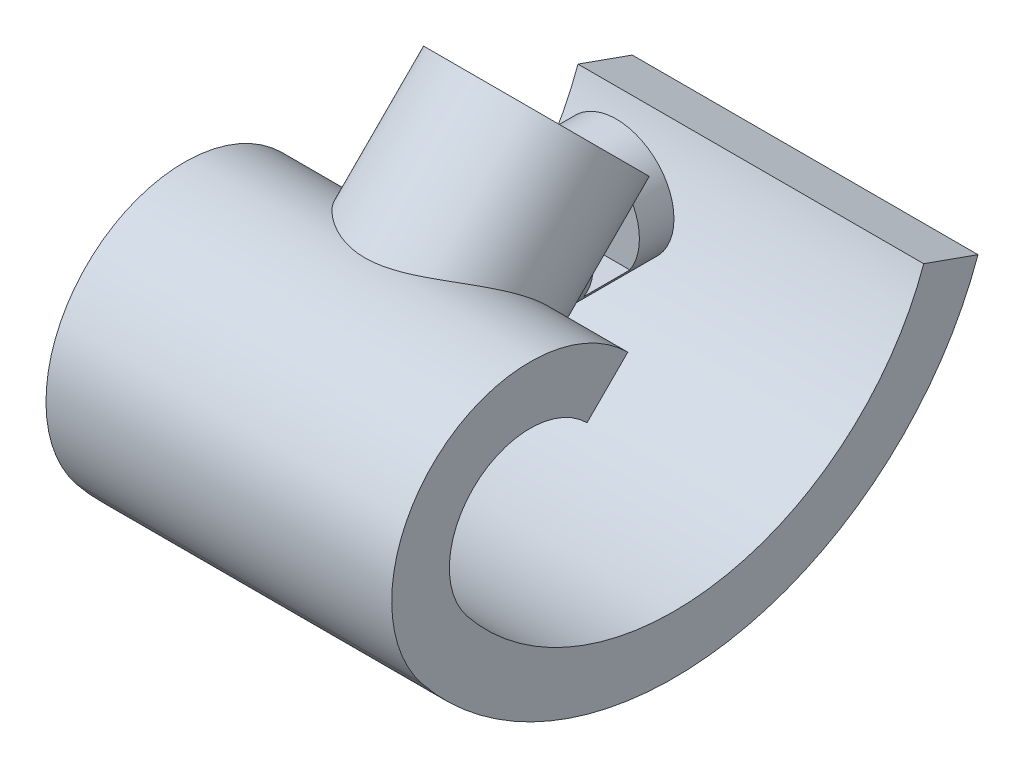
from build123d import *

# Parameters (mm, degrees)
EXTRUDE_THIN1_DEPTH      = 15
BOSS_EXTRUDE1_DEPTH      = 10
BOSS_EXTRUDE1_DEPTH_BACK = 5
SKETCH3_R                = 8
SKETCH3_R_2              = 4
SKETCH5_R                = 5
BOSS_EXTRUDE2_DEPTH      = 10
SKETCH6_R                = 1.5
CUT_EXTRUDE2_DEPTH       = 14
SKETCH4_R                = 4
CUT_EXTRUDE1_DEPTH       = 20
CUT_EXTRUDE3_DEPTH       = 3
CHAMFER1_SIZE            = 1


with BuildPart() as part:
    # Sketch1 → Extrude-Thin1 (new, symmetric)
    with BuildSketch(Plane(origin=(0, 0, 0), x_dir=(0, 0, -1), z_dir=(1, 0, 0))):
        with BuildLine():
            ThreePointArc((-4.004714623, 8.485281374), (-20.494799633, 8.939973084), (-21.857492994, -7.5))
            ThreePointArc((-21.857492994, -7.5), (4.648037658, -17.611514734), (26.382299048, 0.620538558))
            Line((26.382299048, 0.620538558), (21.671174218, 2.295442387))
            ThreePointArc((21.671174218, 2.295442387), (3.818030934, -12.680887103), (-17.954369245, -4.375))
            ThreePointArc((-17.954369245, -4.375), (-17.159464785, 5.214984299), (-7.540248528, 4.949747468))
            Line((-7.540248528, 4.949747468), (-4.004714623, 8.485281374))
        make_face()
    extrude(amount=EXTRUDE_THIN1_DEPTH, both=True)

    # Sketch3 → Boss-Extrude1 (add, two sides: drawn at the far end of the back side and taken through both)
    with BuildSketch(Plane(origin=(0, 2.240283376, -2.240283376), x_dir=(1, 0, 0), z_dir=(0, 0.7071067811865508, -0.7071067811865444)).offset(-BOSS_EXTRUDE1_DEPTH_BACK)):
        with Locations(Location((0, -8.831760866, 0), (0, 0, 270))):
            Circle(SKETCH3_R)
        with Locations(Location((0, -8.831760866, 0), (0, 0, 270))):
            Circle(SKETCH3_R_2, mode=Mode.SUBTRACT)
    extrude(amount=BOSS_EXTRUDE1_DEPTH + BOSS_EXTRUDE1_DEPTH_BACK)

    # Sketch5 → Boss-Extrude2 (add)
    with BuildSketch(Plane.XY):
        with Locations((0, 6.5)):
            Circle(SKETCH5_R)
    extrude(amount=-BOSS_EXTRUDE2_DEPTH)

    # Sketch6 → Cut-Extrude2 (cut)
    with BuildSketch(Plane(origin=(0, 0, -10), x_dir=(-1, 0, 0), z_dir=(0, 0, -1))):
        with Locations((0, 6.5)):
            Circle(SKETCH6_R)
    extrude(amount=-CUT_EXTRUDE2_DEPTH, mode=Mode.SUBTRACT)

    # Sketch4 → Cut-Extrude1 (cut)
    with BuildSketch(Plane(origin=(0, 9.311351188, -9.311351188), x_dir=(1, 0, 0), z_dir=(0, 0.7071067811865507, -0.7071067811865445))):
        with Locations(Location((0, -8.831760866, 0), (0, 0, 270))):
            Circle(SKETCH4_R)
    extrude(amount=-CUT_EXTRUDE1_DEPTH, mode=Mode.SUBTRACT)

    # Sketch7 → Cut-Extrude3 (cut)
    with BuildSketch(Plane(origin=(0, 0, -7), x_dir=(-1, 0, 0), z_dir=(0, 0, -1))):
        Polygon((-1.58771324, 3.75), (1.58771324, 3.75), (3.175426481, 6.5), (1.58771324, 9.25), (-1.58771324, 9.25), (-3.175426481, 6.5), align=None)
        Polygon((-18.560605148, 9.25), (-18.560605148, 3.75), (-1.58771324, 3.75), (-3.175426481, 6.5), (-1.58771324, 9.25), align=None)
    extrude(amount=-CUT_EXTRUDE3_DEPTH, mode=Mode.SUBTRACT)

    # Chamfer1
    chamfer1_edges = [part.edges().sort_by_distance(p)[0] for p in [
        (4.789525883, 5.064576084, -4),
    ]]
    chamfer(chamfer1_edges, length=CHAMFER1_SIZE)


solid = part.part
